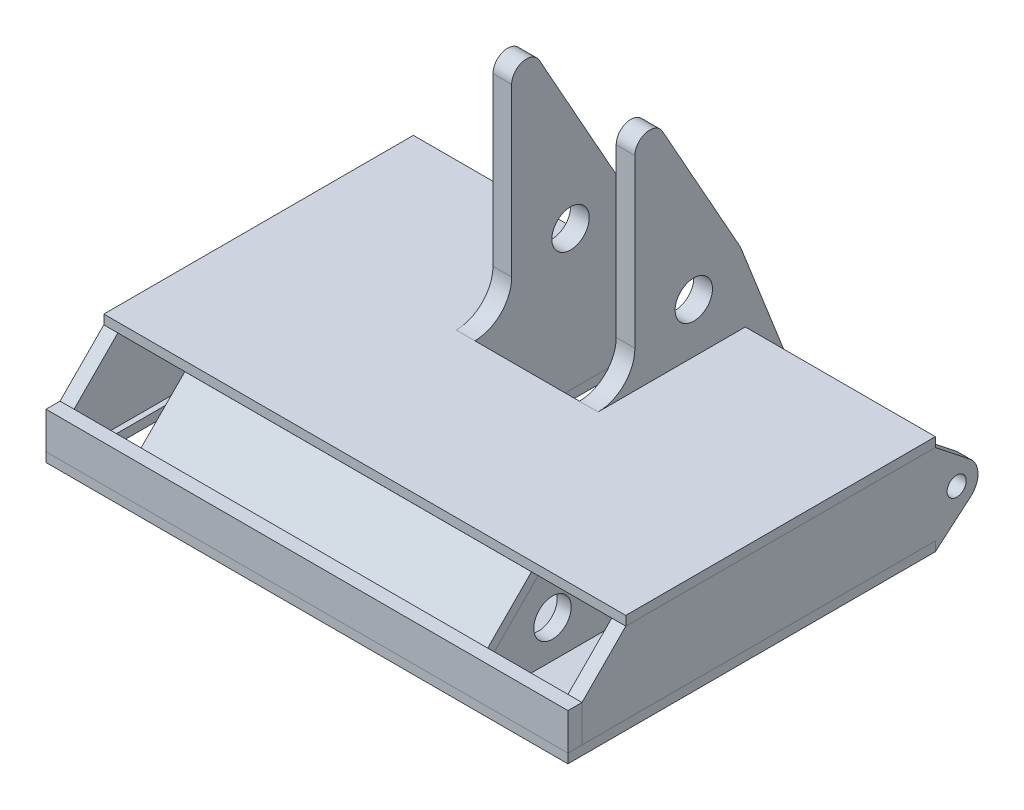
from build123d import *

# Parameters (mm, degrees)
SKETCH14_W              = 71
SKETCH14_H              = 55
BOSS_EXTRUDE9_DEPTH     = 9.525
SKETCH2_W               = 26.225
SKETCH2_H               = 56.459609462
BOTTOM_PLATE_DEPTH      = 6.35
SKETCH3_R               = 12.7
SKETCH3_R_2             = 6.5
LEFT_WEAPON_WALL_DEPTH  = 12.7
SKETCH5_R               = 6.5
LEFT_WALL_DEPTH         = 9.525
LEFT_MOTOR_WALL_DEPTH   = 9.525
SKETCH7_W               = 354.5
SKETCH7_H               = 25
REAR_WALL_DEPTH         = 9.525
SKETCH8_W               = 119.525
SKETCH8_H               = 55
BOSS_EXTRUDE6_DEPTH     = 9.525
SKETCH10_R              = 12.7
SKETCH10_R_2            = 20.5
CUT_EXTRUDE1_DEPTH      = 9.525
SKETCH11_R              = 12.7
CUT_EXTRUDE2_DEPTH      = 9.525
SKETCH12_W              = 42.252558595
SKETCH12_H              = 235.45
REAR_ANGLED_PLATE_DEPTH = 6.35
TOP_PLATE_DEPTH         = 6.35
SKETCH15_R              = 20.5
CUT_EXTRUDE3_DEPTH      = 12.7


with BuildPart() as part:
    # Sketch14 → Boss-Extrude9 (new body)
    with BuildSketch(Plane.XY.offset(-104)):
        with Locations((0, 27.5)):
            Rectangle(SKETCH14_W, SKETCH14_H)
    extrude(amount=BOSS_EXTRUDE9_DEPTH)

    # Sketch2 → Bottom Plate (add)
    with BuildSketch(Plane(origin=(0, 0, 0), x_dir=(1, 0, 0), z_dir=(0, 1, 0))):
        Polygon((177.25, -9.525), (177.25, 0), (177.25, 240), (35.5, 240), (35.5, 145), (-35.5, 145), (-35.5, 240), (-177.25, 240), (-177.25, 0), (-177.25, -9.525), align=None)
        with Locations((-150.8375, 190.9625)):
            Rectangle(SKETCH2_W, SKETCH2_H, mode=Mode.SUBTRACT)
        with Locations((-150.8375, 39.5125)):
            Rectangle(SKETCH2_W, SKETCH2_H, mode=Mode.SUBTRACT)
    extrude(amount=-BOTTOM_PLATE_DEPTH)


with BuildPart() as body_2:
    # Sketch3 → Left Weapon Wall (new body)
    with BuildSketch(Plane(origin=(-35.5, 0, 0), x_dir=(0, 0, -1), z_dir=(1, 0, 0))):
        with BuildLine():
            Line((140, 55), (29.753633523, 55))
            Line((29.753633523, 55), (0, 25))
            Line((0, 25), (0, 0))
            Line((0, 0), (240, 0))
            Line((240, 0), (240, -6.35))
            Line((240, -6.35), (263.889455586, 13.950650526))
            ThreePointArc((263.889455586, 13.950650526), (268.562793371, 21.466185826), (267.997390684, 30.298154841))
            Line((267.997390684, 30.298154841), (237.579908548, 107.788649616))
            ThreePointArc((237.579908548, 107.788649616), (236.629676676, 109.985444717), (235.531525088, 112.112158712))
            Line((235.531525088, 112.112158712), (183.723292882, 204.548441471))
            ThreePointArc((183.723292882, 204.548441471), (172.473434032, 209.334813428), (165, 199.659253268))
            Line((165, 199.659253268), (165, 86.35))
            ThreePointArc((165, 86.35), (157.67766953, 68.67233047), (140, 61.35))
            Line((140, 61.35), (140, 55))
        make_face()
        with Locations((205, 95)):
            Circle(SKETCH3_R, mode=Mode.SUBTRACT)
        with Locations((254.5, 25)):
            Circle(SKETCH3_R_2, mode=Mode.SUBTRACT)
    extrude(amount=-LEFT_WEAPON_WALL_DEPTH)


with BuildPart() as body_3:
    # Sketch5 → Left Wall (new body)
    with BuildSketch(Plane(origin=(-177.25, 0, 0), x_dir=(0, 0, -1), z_dir=(1, 0, 0))):
        with BuildLine():
            Line((0, 0), (240, 0))
            Line((240, 0), (240, -6.35))
            Line((240, -6.35), (263.889455586, 13.950650526))
            ThreePointArc((263.889455586, 13.950650526), (268.99790258, 25.246618677), (263.50821887, 36.362305787))
            Line((263.50821887, 36.362305787), (240, 55))
            Line((240, 55), (29.753633523, 55))
            Line((29.753633523, 55), (0, 25))
            Line((0, 25), (0, 0))
        make_face()
        with Locations((254.5, 25)):
            Circle(SKETCH5_R, mode=Mode.SUBTRACT)
    extrude(amount=LEFT_WALL_DEPTH)


with BuildPart() as body_4:
    # Sketch6 → Left Motor Wall (new body)
    with BuildSketch(Plane(origin=(-108.2, 0, 0), x_dir=(0, 0, -1), z_dir=(1, 0, 0))):
        Polygon((230.475, 0), (0, 0), (0, 25), (29.753633523, 55), (230.475, 55), align=None)
    extrude(amount=-LEFT_MOTOR_WALL_DEPTH)


with BuildPart() as body_5:
    # Sketch7 → Rear Wall (new body)
    with BuildSketch(Plane.XY.offset(9.525)):
        with Locations((0, 12.5)):
            Rectangle(SKETCH7_W, SKETCH7_H)
    extrude(amount=-REAR_WALL_DEPTH)


with BuildPart() as body_6:
    # Sketch8 → Boss-Extrude6 (new body)
    with BuildSketch(Plane.XY.offset(-240)):
        with Locations((-107.9625, 27.5)):
            Rectangle(SKETCH8_W, SKETCH8_H)
    extrude(amount=BOSS_EXTRUDE6_DEPTH)


with BuildPart() as body_7:
    # Mirror1: mirrored copy
    add(body_3.part.mirror(Plane(origin=(0, 0, 0), x_dir=(0, 0, 1), z_dir=(1, 0, 0))))


with BuildPart() as body_8:
    # Mirror1 2: mirrored copy
    add(body_6.part.mirror(Plane(origin=(0, 0, 0), x_dir=(0, 0, 1), z_dir=(1, 0, 0))))


with BuildPart() as body_9:
    # Mirror1 3: mirrored copy
    add(body_2.part.mirror(Plane(origin=(0, 0, 0), x_dir=(0, 0, 1), z_dir=(1, 0, 0))))

    # Sketch15 → Cut-Extrude3 (cut)
    with BuildSketch(Plane(origin=(48.2, 0, 0), x_dir=(0, 0, -1), z_dir=(1, 0, 0))):
        with Locations(Location((125, 25.4, 0), (0, 0, 180))):
            Circle(SKETCH15_R)
    extrude(amount=-CUT_EXTRUDE3_DEPTH, mode=Mode.SUBTRACT)


with BuildPart() as body_10:
    # Mirror1 4: mirrored copy
    add(body_4.part.mirror(Plane(origin=(0, 0, 0), x_dir=(0, 0, 1), z_dir=(1, 0, 0))))

    # Sketch10 → Cut-Extrude1 (cut)
    with BuildSketch(Plane.ZY.offset(-108.2)):
        with Locations((-190.9625, 25.4)):
            Circle(SKETCH10_R)
        with Locations((-39.5125, 25.4)):
            Circle(SKETCH10_R)
        with Locations((-125, 25.4)):
            Circle(SKETCH10_R_2)
    extrude(amount=-CUT_EXTRUDE1_DEPTH, mode=Mode.SUBTRACT)


with BuildPart() as body_4_1:
    add(body_4.part)

    # Sketch11 → Cut-Extrude2 (cut)
    with BuildSketch(Plane.ZY.offset(117.725)):
        with Locations((-39.5125, 25.4)):
            Circle(SKETCH11_R)
        with Locations((-190.9625, 25.4)):
            Circle(SKETCH11_R)
    extrude(amount=-CUT_EXTRUDE2_DEPTH, mode=Mode.SUBTRACT)


with BuildPart() as body_11:
    # Sketch12 → Rear Angled Plate (new body)
    with BuildSketch(Plane(origin=(0, 12.396925813, 12.499575021), x_dir=(0, 0.7100161741083807, -0.7041853679994337), z_dir=(0, -0.7041853679994337, -0.7100161741083807))):
        with Locations((38.87668365, 0)):
            Rectangle(SKETCH12_W, SKETCH12_H)
    extrude(amount=-REAR_ANGLED_PLATE_DEPTH)


with BuildPart() as body_12:
    # Sketch13 → Top Plate (new body)
    with BuildSketch(Plane(origin=(0, 55, 0), x_dir=(1, 0, 0), z_dir=(0, 1, 0))):
        Polygon((177.25, 29.753633523), (177.25, 240), (48.2, 240), (48.2, 230.475), (48.2, 140), (-48.2, 140), (-48.2, 230.475), (-48.2, 240), (-177.25, 240), (-177.25, 29.753633523), align=None)
    extrude(amount=TOP_PLATE_DEPTH)


solid = Compound([part.part, body_2.part, body_3.part, body_5.part, body_6.part, body_7.part, body_8.part, body_9.part, body_10.part, body_4_1.part, body_11.part, body_12.part])
